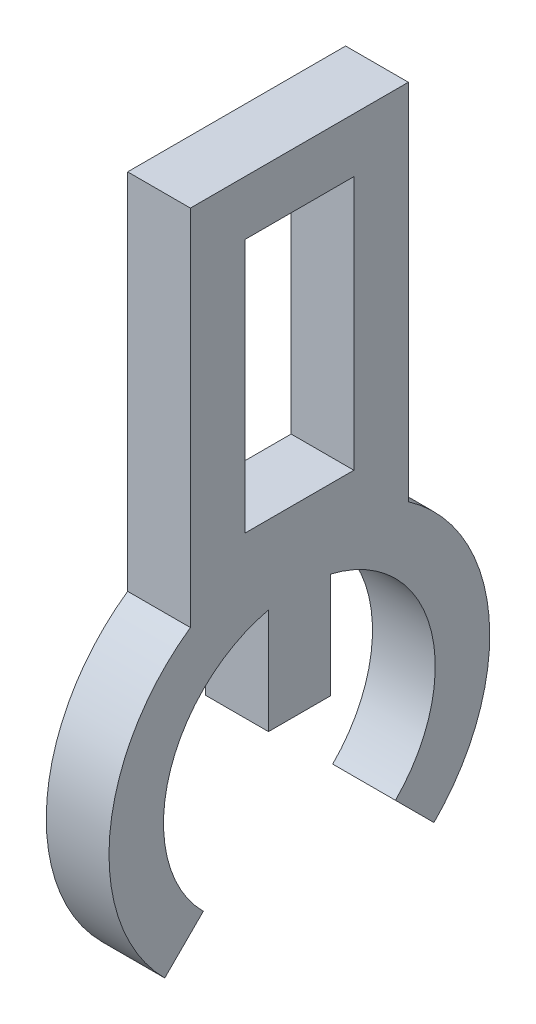
from build123d import *

# Parameters (mm, degrees)
SKETCH1_W           = 3
SKETCH1_H           = 7
BOSS_EXTRUDE1_DEPTH = 1.7272


with BuildPart() as part:
    # Sketch1 → Boss-Extrude1 (new body)
    with BuildSketch(Plane(origin=(0, 0, 0), x_dir=(0, 0, -1), z_dir=(1, 0, 0))):
        with BuildLine():
            Line((-3.705239533, -3.705239533), (-2.644579362, -2.644579362))
            ThreePointArc((-2.644579362, -2.644579362), (-3.596344694, 1.026598676), (-0.85, 3.642128499))
            Line((-0.85, 3.642128499), (-0.85, 0.74))
            Line((-0.85, 0.74), (0.85, 0.74))
            Line((0.85, 0.74), (0.85, 3.642128499))
            ThreePointArc((0.85, 3.642128499), (3.596344694, 1.026598676), (2.644579362, -2.644579362))
            Line((2.644579362, -2.644579362), (3.705239533, -3.705239533))
            ThreePointArc((3.705239533, -3.705239533), (5.219764516, 0.460063475), (3, 4.296230906))
            Line((3, 4.296230906), (3, 14.296230906))
            Line((3, 14.296230906), (-3, 14.296230906))
            Line((-3, 14.296230906), (-3, 4.296230906))
            ThreePointArc((-3, 4.296230906), (-5.219764516, 0.460063475), (-3.705239533, -3.705239533))
        make_face()
        with Locations((0, 9.296230906)):
            Rectangle(SKETCH1_W, SKETCH1_H, mode=Mode.SUBTRACT)
    extrude(amount=BOSS_EXTRUDE1_DEPTH)


solid = part.part
